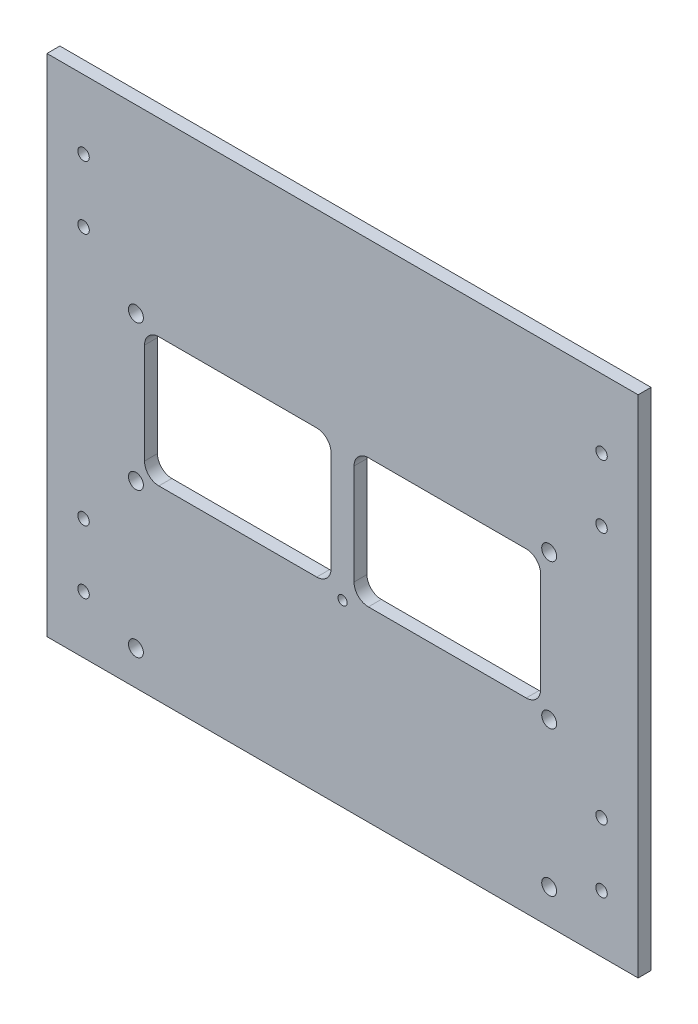
from build123d import *

# Parameters (mm, degrees)
SKETCH_1_W          = 206
SKETCH_1_H          = 176
EXTRUDE_1_DEPTH     = 4.5
CUT_EXTRUDE_1_REACH = 272.984
SKETCH_2_R          = 2
CUT_EXTRUDE_2_REACH = 272.984
SKETCH_3_R          = 2.6
SKETCH_3_R_2        = 1.6


with BuildPart() as part:
    # 草图1 → 凸台-拉伸1 (new body)
    with BuildSketch(Plane.XY):
        with Locations((103, 88)):
            Rectangle(SKETCH_1_W, SKETCH_1_H)
    extrude(amount=EXTRUDE_1_DEPTH)

    # 草图2 → 切除-拉伸1 (cut, up to next)
    with BuildSketch(Plane.XY.offset(4.5), mode=Mode.PRIVATE) as cut_extrude_1_sk1:
        with Locations((12.75, 152)):
            Circle(SKETCH_2_R)
    cut_extrude_1_tool1 = extrude(cut_extrude_1_sk1.sketch, amount=-CUT_EXTRUDE_1_REACH, mode=Mode.PRIVATE) & part.part
    # 草图2 → 切除-拉伸1 (cut, up to next)
    with BuildSketch(Plane.XY.offset(4.5), mode=Mode.PRIVATE) as cut_extrude_1_sk2:
        with Locations((12.75, 130)):
            Circle(SKETCH_2_R)
    cut_extrude_1_tool2 = extrude(cut_extrude_1_sk2.sketch, amount=-CUT_EXTRUDE_1_REACH, mode=Mode.PRIVATE) & part.part
    # 草图2 → 切除-拉伸1 (cut, up to next)
    with BuildSketch(Plane.XY.offset(4.5), mode=Mode.PRIVATE) as cut_extrude_1_sk3:
        with Locations((12.75, 42)):
            Circle(SKETCH_2_R)
    cut_extrude_1_tool3 = extrude(cut_extrude_1_sk3.sketch, amount=-CUT_EXTRUDE_1_REACH, mode=Mode.PRIVATE) & part.part
    # 草图2 → 切除-拉伸1 (cut, up to next)
    with BuildSketch(Plane.XY.offset(4.5), mode=Mode.PRIVATE) as cut_extrude_1_sk4:
        with Locations((12.75, 20)):
            Circle(SKETCH_2_R)
    cut_extrude_1_tool4 = extrude(cut_extrude_1_sk4.sketch, amount=-CUT_EXTRUDE_1_REACH, mode=Mode.PRIVATE) & part.part
    # 草图2 → 切除-拉伸1 (cut, up to next)
    with BuildSketch(Plane.XY.offset(4.5), mode=Mode.PRIVATE) as cut_extrude_1_sk5:
        with Locations(Location((193.25, 20, 0), (0, 0, 180))):
            Circle(SKETCH_2_R)
    cut_extrude_1_tool5 = extrude(cut_extrude_1_sk5.sketch, amount=-CUT_EXTRUDE_1_REACH, mode=Mode.PRIVATE) & part.part
    # 草图2 → 切除-拉伸1 (cut, up to next)
    with BuildSketch(Plane.XY.offset(4.5), mode=Mode.PRIVATE) as cut_extrude_1_sk6:
        with Locations(Location((193.25, 42, 0), (0, 0, 180))):
            Circle(SKETCH_2_R)
    cut_extrude_1_tool6 = extrude(cut_extrude_1_sk6.sketch, amount=-CUT_EXTRUDE_1_REACH, mode=Mode.PRIVATE) & part.part
    # 草图2 → 切除-拉伸1 (cut, up to next)
    with BuildSketch(Plane.XY.offset(4.5), mode=Mode.PRIVATE) as cut_extrude_1_sk7:
        with Locations(Location((193.25, 130, 0), (0, 0, 180))):
            Circle(SKETCH_2_R)
    cut_extrude_1_tool7 = extrude(cut_extrude_1_sk7.sketch, amount=-CUT_EXTRUDE_1_REACH, mode=Mode.PRIVATE) & part.part
    # 草图2 → 切除-拉伸1 (cut, up to next)
    with BuildSketch(Plane.XY.offset(4.5), mode=Mode.PRIVATE) as cut_extrude_1_sk8:
        with Locations(Location((193.25, 152, 0), (0, 0, 180))):
            Circle(SKETCH_2_R)
    cut_extrude_1_tool8 = extrude(cut_extrude_1_sk8.sketch, amount=-CUT_EXTRUDE_1_REACH, mode=Mode.PRIVATE) & part.part
    add(cut_extrude_1_tool1.solids().sort_by_distance((12.75, 152, 4.5))[0], mode=Mode.SUBTRACT)
    add(cut_extrude_1_tool2.solids().sort_by_distance((12.75, 130, 4.5))[0], mode=Mode.SUBTRACT)
    add(cut_extrude_1_tool3.solids().sort_by_distance((12.75, 42, 4.5))[0], mode=Mode.SUBTRACT)
    add(cut_extrude_1_tool4.solids().sort_by_distance((12.75, 20, 4.5))[0], mode=Mode.SUBTRACT)
    add(cut_extrude_1_tool5.solids().sort_by_distance((193.25, 20, 4.5))[0], mode=Mode.SUBTRACT)
    add(cut_extrude_1_tool6.solids().sort_by_distance((193.25, 42, 4.5))[0], mode=Mode.SUBTRACT)
    add(cut_extrude_1_tool7.solids().sort_by_distance((193.25, 130, 4.5))[0], mode=Mode.SUBTRACT)
    add(cut_extrude_1_tool8.solids().sort_by_distance((193.25, 152, 4.5))[0], mode=Mode.SUBTRACT)

    # 草图3 → 切除-拉伸2 (cut, up to next)
    with BuildSketch(Plane.XY.offset(4.5), mode=Mode.PRIVATE) as cut_extrude_2_sk1:
        with Locations((31, 113)):
            Circle(SKETCH_3_R)
    cut_extrude_2_tool1 = extrude(cut_extrude_2_sk1.sketch, amount=-CUT_EXTRUDE_2_REACH, mode=Mode.PRIVATE) & part.part
    # 草图3 → 切除-拉伸2 (cut, up to next)
    with BuildSketch(Plane.XY.offset(4.5), mode=Mode.PRIVATE) as cut_extrude_2_sk2:
        with Locations((31, 62.5)):
            Circle(SKETCH_3_R)
    cut_extrude_2_tool2 = extrude(cut_extrude_2_sk2.sketch, amount=-CUT_EXTRUDE_2_REACH, mode=Mode.PRIVATE) & part.part
    # 草图3 → 切除-拉伸2 (cut, up to next)
    with BuildSketch(Plane.XY.offset(4.5), mode=Mode.PRIVATE) as cut_extrude_2_sk3:
        with Locations((31, 12)):
            Circle(SKETCH_3_R)
    cut_extrude_2_tool3 = extrude(cut_extrude_2_sk3.sketch, amount=-CUT_EXTRUDE_2_REACH, mode=Mode.PRIVATE) & part.part
    # 草图3 → 切除-拉伸2 (cut, up to next)
    with BuildSketch(Plane.XY.offset(4.5), mode=Mode.PRIVATE) as cut_extrude_2_sk4:
        with Locations((175, 12)):
            Circle(SKETCH_3_R)
    cut_extrude_2_tool4 = extrude(cut_extrude_2_sk4.sketch, amount=-CUT_EXTRUDE_2_REACH, mode=Mode.PRIVATE) & part.part
    # 草图3 → 切除-拉伸2 (cut, up to next)
    with BuildSketch(Plane.XY.offset(4.5), mode=Mode.PRIVATE) as cut_extrude_2_sk5:
        with Locations((175, 62.5)):
            Circle(SKETCH_3_R)
    cut_extrude_2_tool5 = extrude(cut_extrude_2_sk5.sketch, amount=-CUT_EXTRUDE_2_REACH, mode=Mode.PRIVATE) & part.part
    # 草图3 → 切除-拉伸2 (cut, up to next)
    with BuildSketch(Plane.XY.offset(4.5), mode=Mode.PRIVATE) as cut_extrude_2_sk6:
        with Locations((175, 113)):
            Circle(SKETCH_3_R)
    cut_extrude_2_tool6 = extrude(cut_extrude_2_sk6.sketch, amount=-CUT_EXTRUDE_2_REACH, mode=Mode.PRIVATE) & part.part
    # 草图3 → 切除-拉伸2 (cut, up to next)
    with BuildSketch(Plane.XY.offset(4.5), mode=Mode.PRIVATE) as cut_extrude_2_sk7:
        with Locations((103, 62.5)):
            Circle(SKETCH_3_R_2)
    cut_extrude_2_tool7 = extrude(cut_extrude_2_sk7.sketch, amount=-CUT_EXTRUDE_2_REACH, mode=Mode.PRIVATE) & part.part
    # 草图3 → 切除-拉伸2 (cut, up to next)
    with BuildSketch(Plane.XY.offset(4.5), mode=Mode.PRIVATE) as cut_extrude_2_sk8:
        with BuildLine():
            Line((167, 65), (112, 65))
            ThreePointArc((112, 65), (108.464466094, 66.464466094), (107, 70))
            Line((107, 70), (107, 105))
            ThreePointArc((107, 105), (108.464466094, 108.535533906), (112, 110))
            Line((112, 110), (167, 110))
            ThreePointArc((167, 110), (170.535533906, 108.535533906), (172, 105))
            Line((172, 105), (172, 70))
            ThreePointArc((172, 70), (170.535533906, 66.464466094), (167, 65))
        make_face()
    cut_extrude_2_tool8 = extrude(cut_extrude_2_sk8.sketch, amount=-CUT_EXTRUDE_2_REACH, mode=Mode.PRIVATE) & part.part
    # 草图3 → 切除-拉伸2 (cut, up to next)
    with BuildSketch(Plane.XY.offset(4.5), mode=Mode.PRIVATE) as cut_extrude_2_sk9:
        with BuildLine():
            Line((39, 110), (94, 110))
            ThreePointArc((94, 110), (97.535533906, 108.535533906), (99, 105))
            Line((99, 105), (99, 70))
            ThreePointArc((99, 70), (97.535533906, 66.464466094), (94, 65))
            Line((94, 65), (39, 65))
            ThreePointArc((39, 65), (35.464466094, 66.464466094), (34, 70))
            Line((34, 70), (34, 105))
            ThreePointArc((34, 105), (35.464466094, 108.535533906), (39, 110))
        make_face()
    cut_extrude_2_tool9 = extrude(cut_extrude_2_sk9.sketch, amount=-CUT_EXTRUDE_2_REACH, mode=Mode.PRIVATE) & part.part
    add(cut_extrude_2_tool1.solids().sort_by_distance((31, 113, 4.5))[0], mode=Mode.SUBTRACT)
    add(cut_extrude_2_tool2.solids().sort_by_distance((31, 62.5, 4.5))[0], mode=Mode.SUBTRACT)
    add(cut_extrude_2_tool3.solids().sort_by_distance((31, 12, 4.5))[0], mode=Mode.SUBTRACT)
    add(cut_extrude_2_tool4.solids().sort_by_distance((175, 12, 4.5))[0], mode=Mode.SUBTRACT)
    add(cut_extrude_2_tool5.solids().sort_by_distance((175, 62.5, 4.5))[0], mode=Mode.SUBTRACT)
    add(cut_extrude_2_tool6.solids().sort_by_distance((175, 113, 4.5))[0], mode=Mode.SUBTRACT)
    add(cut_extrude_2_tool7.solids().sort_by_distance((103, 62.5, 4.5))[0], mode=Mode.SUBTRACT)
    add(cut_extrude_2_tool8.solids().sort_by_distance((139.5, 87.5, 4.5))[0], mode=Mode.SUBTRACT)
    add(cut_extrude_2_tool9.solids().sort_by_distance((66.5, 87.5, 4.5))[0], mode=Mode.SUBTRACT)


solid = part.part
